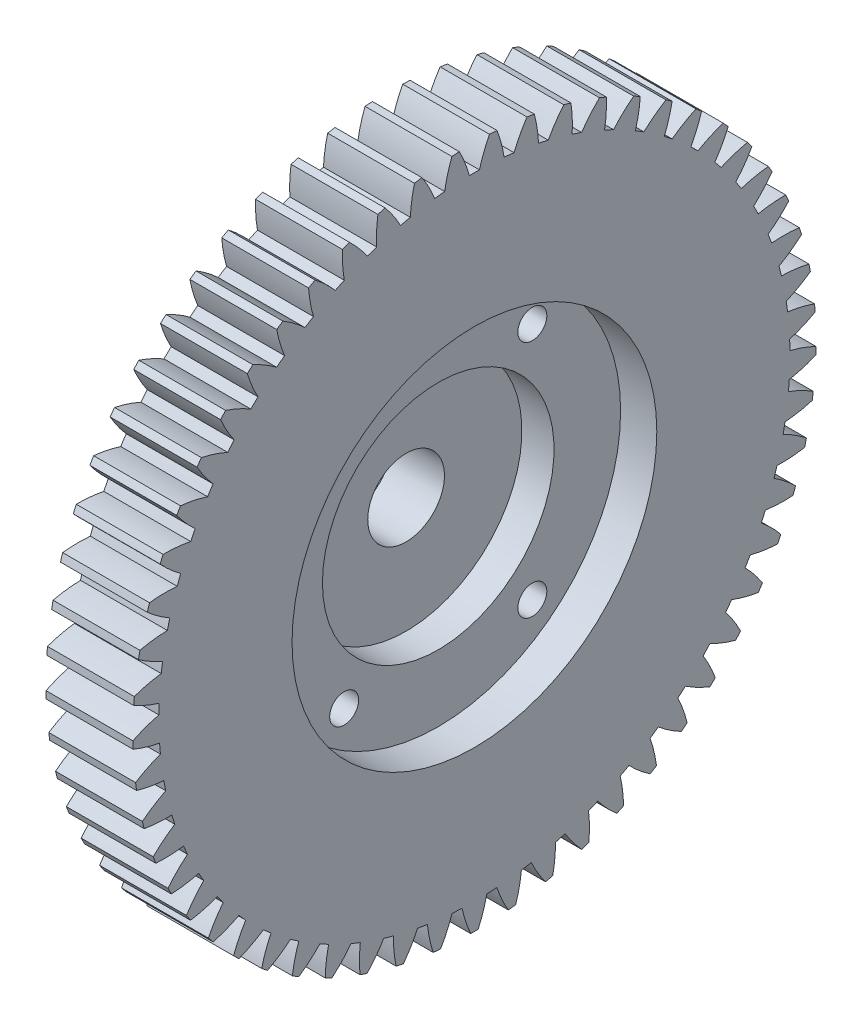
from build123d import *

# Parameters (mm, degrees)
BASPROSKE_W             = 6
BASPROSKE_H             = 23.6
TOOTHCUT_DEPTH          = 34.910470359
TEETHCUTS_COUNT         = 57
TEETHCUTS_ANGLE         = 353.684210526
BORSKE_R                = 0.4
BORE_DEPTH              = 50.003048
ENL_V_MAT_EXTRU_2_REACH = 35.908
ESQUISSE4_R             = 1
ESQUISSE5_R             = 2
ENL_V_MAT_EXTRU_3_DEPTH = 1.5


with BuildPart() as part:
    # BasProSke → Base-Revolve (revolve)
    with BuildSketch(Plane(origin=(0, 0, 0), x_dir=(1, 0, 0), z_dir=(0, 1, 0)), mode=Mode.PRIVATE) as base_revolve_sk:
        with Locations((3, 11.8)):
            Rectangle(BASPROSKE_W, BASPROSKE_H)
    revolve(base_revolve_sk.sketch.rotate(Axis((-10, 0, 0), (1, 0, 0)), 180), axis=Axis((-10, 0, 0), (1, 0, 0)))

    # TooCutSke → ToothCut (cut, through all)
    with BuildSketch(Plane(origin=(0, 0, 0), x_dir=(0, 0, -1), z_dir=(1, 0, 0))):
        with BuildLine():
            ThreePointArc((0.344989867, 21.796269933), (0, 21.799), (-0.344989867, 21.796269933))
            ThreePointArc((-0.344989867, 21.796269933), (-0.652109251, 22.717989512), (-1.055535983, 23.601808595))
            ThreePointArc((-1.055535983, 23.601808595), (0, 23.6254), (1.055535983, 23.601808595))
            ThreePointArc((1.055535983, 23.601808595), (0.652109251, 22.717989512), (0.344989867, 21.796269933))
        make_face()
    toothcut = extrude(amount=TOOTHCUT_DEPTH, mode=Mode.SUBTRACT)

    # TeethCuts: ToothCut ×57 about axis
    teethcuts_axis = Axis((-10, 0, 0), (1, 0, 0))
    for i in range(1, TEETHCUTS_COUNT):
        add(toothcut.rotate(teethcuts_axis, i * TEETHCUTS_ANGLE / (TEETHCUTS_COUNT - 1)), mode=Mode.SUBTRACT)

    # BorSke → Bore (cut, symmetric)
    with BuildSketch(Plane(origin=(0, 0, 0), x_dir=(0, 0, -1), z_dir=(1, 0, 0))):
        with Locations(Location((0, 0, 0), (0, 0, 180))):
            Circle(BORSKE_R)
    extrude(amount=BORE_DEPTH, both=True, mode=Mode.SUBTRACT)

    # Esquisse2 → Révolution1 (revolve)
    with BuildSketch(Plane(origin=(0, 0, 0), x_dir=(1, 0, 0), z_dir=(0, 1, 0)), mode=Mode.PRIVATE) as r_volution1_sk:
        Polygon((-4.4, 0), (-4.4, -4.85), (-0.4, -4.85), (-0.4, -5.5), (0, -5.5), (0, 0), align=None)
    revolve(r_volution1_sk.sketch.rotate(Axis((7.259116639, 0, 0), (-1, 0, 0)), 180), axis=Axis((7.259116639, 0, 0), (-1, 0, 0)))

    # Esquisse3 → Enlèvement de matière-Révolution1 (revolve, cut)
    with BuildSketch(Plane(origin=(0, 0, 0), x_dir=(1, 0, 0), z_dir=(0, 1, 0))):
        Polygon((-4.4, -4.15), (-2.4, -4.15), (-2.4, -2.65), (1.28, -2.65), (1.28, -8), (3.5, -8), (3.5, -12.6), (6, -12.6), (6, 0), (-4.4, 0), align=None)
    revolve(axis=Axis((-8.074075107, 0, 0), (1, 0, 0)), mode=Mode.SUBTRACT)

    # Esquisse4 → Enlèv. mat.-Extru.2 (cut, up to next)
    with BuildSketch(Plane.ZY, mode=Mode.PRIVATE) as enl_v_mat_extru_2_sk1:
        with Locations((-6.5, 8.25)):
            Circle(ESQUISSE4_R)
    enl_v_mat_extru_2_tool1 = extrude(enl_v_mat_extru_2_sk1.sketch, amount=-ENL_V_MAT_EXTRU_2_REACH, mode=Mode.PRIVATE) & part.part
    # Esquisse4 → Enlèv. mat.-Extru.2 (cut, up to next)
    with BuildSketch(Plane.ZY, mode=Mode.PRIVATE) as enl_v_mat_extru_2_sk2:
        with Locations((-6.5, -8.25)):
            Circle(ESQUISSE4_R)
    enl_v_mat_extru_2_tool2 = extrude(enl_v_mat_extru_2_sk2.sketch, amount=-ENL_V_MAT_EXTRU_2_REACH, mode=Mode.PRIVATE) & part.part
    # Esquisse4 → Enlèv. mat.-Extru.2 (cut, up to next)
    with BuildSketch(Plane.ZY, mode=Mode.PRIVATE) as enl_v_mat_extru_2_sk3:
        with Locations((6.5, -8.25)):
            Circle(ESQUISSE4_R)
    enl_v_mat_extru_2_tool3 = extrude(enl_v_mat_extru_2_sk3.sketch, amount=-ENL_V_MAT_EXTRU_2_REACH, mode=Mode.PRIVATE) & part.part
    # Esquisse4 → Enlèv. mat.-Extru.2 (cut, up to next)
    with BuildSketch(Plane.ZY, mode=Mode.PRIVATE) as enl_v_mat_extru_2_sk4:
        with Locations((6.5, 8.25)):
            Circle(ESQUISSE4_R)
    enl_v_mat_extru_2_tool4 = extrude(enl_v_mat_extru_2_sk4.sketch, amount=-ENL_V_MAT_EXTRU_2_REACH, mode=Mode.PRIVATE) & part.part
    add(enl_v_mat_extru_2_tool1.solids().sort_by_distance((0, 8.25, -6.5))[0], mode=Mode.SUBTRACT)
    add(enl_v_mat_extru_2_tool2.solids().sort_by_distance((0, -8.25, -6.5))[0], mode=Mode.SUBTRACT)
    add(enl_v_mat_extru_2_tool3.solids().sort_by_distance((0, -8.25, 6.5))[0], mode=Mode.SUBTRACT)
    add(enl_v_mat_extru_2_tool4.solids().sort_by_distance((0, 8.25, 6.5))[0], mode=Mode.SUBTRACT)

    # Esquisse5 → Enlèv. mat.-Extru.3 (cut)
    with BuildSketch(Plane.ZY):
        with Locations((-6.5, 8.25)):
            Circle(ESQUISSE5_R)
        with Locations((6.5, 8.25)):
            Circle(ESQUISSE5_R)
        with Locations((6.5, -8.25)):
            Circle(ESQUISSE5_R)
        with Locations((-6.5, -8.25)):
            Circle(ESQUISSE5_R)
    extrude(amount=-ENL_V_MAT_EXTRU_3_DEPTH, mode=Mode.SUBTRACT)


solid = part.part
